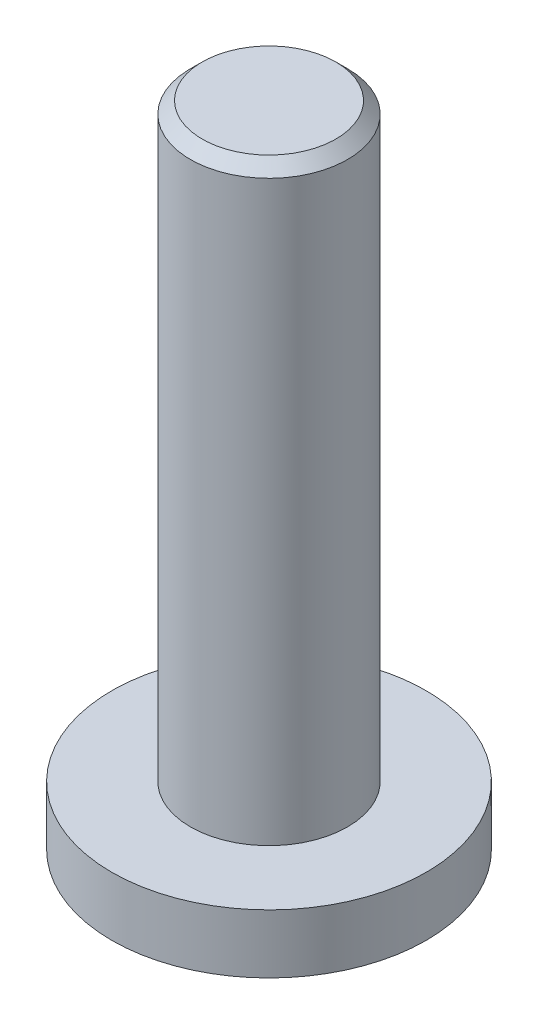
from build123d import *

# Parameters (mm, degrees)
SKETCH_1_R      = 8
EXTRUDE_1_DEPTH = 3
SKETCH_2_R      = 4
EXTRUDE_2_DEPTH = 30
CHAMFER_1_SIZE  = 0.6


with BuildPart() as part:
    # Эскиз1 → Бобышка-Вытянуть1 (new body)
    with BuildSketch(Plane(origin=(0, 0, 0), x_dir=(1, 0, 0), z_dir=(0, 1, 0))):
        with Locations(Location((0, 0, 0), (0, 0, 270))):
            Circle(SKETCH_1_R)
    extrude(amount=EXTRUDE_1_DEPTH)

    # Эскиз2 → Бобышка-Вытянуть2 (add)
    with BuildSketch(Plane(origin=(0, 3, 0), x_dir=(1, 0, 0), z_dir=(0, 1, 0))):
        with Locations(Location((0, 0, 0), (0, 0, 270))):
            Circle(SKETCH_2_R)
    extrude(amount=EXTRUDE_2_DEPTH)

    # Эскиз3 → Вырез-Повернуть1 (revolve, cut)
    with BuildSketch(Plane(origin=(0, 0, 0), x_dir=(0, 0, -1), z_dir=(1, 0, 0)), mode=Mode.PRIVATE) as cut_revolve_1_sk:
        Polygon((-8, 0), (0, 2.143593539), (0, 0), align=None)
    revolve(cut_revolve_1_sk.sketch.rotate(Axis((0, 2.143593539, 0), (0, -1, 0)), 180), axis=Axis((0, 2.143593539, 0), (0, -1, 0)), mode=Mode.SUBTRACT)

    # Фаска1
    chamfer_1_edges = [part.edges().sort_by_distance(p)[0] for p in [
        (0, 33, -4),
    ]]
    chamfer(chamfer_1_edges, length=CHAMFER_1_SIZE)


solid = part.part
